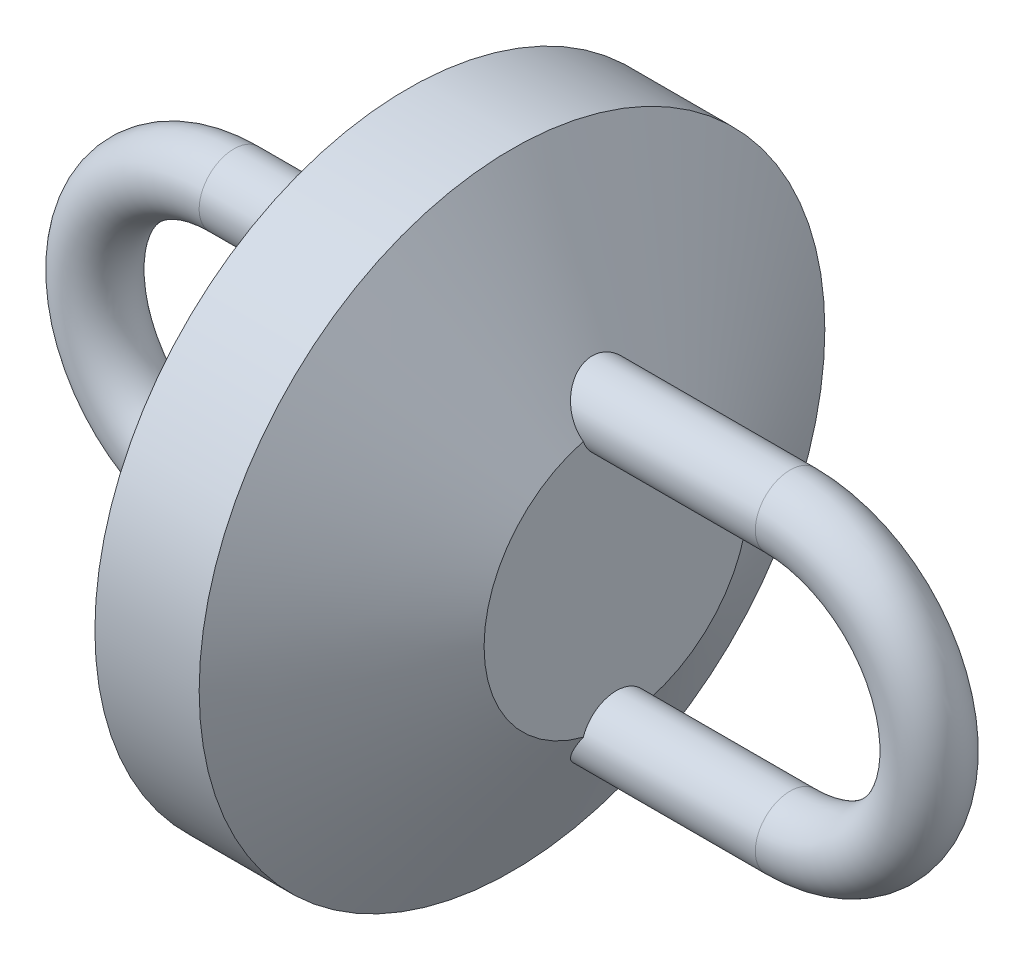
from build123d import *

# Parameters (mm, degrees)
SWEEP_1_PROFILE_R         = 1
SKETCH_9_R                = 9
EXTRUDE_1_DEPTH           = 3
EXTRUDE_1_TAPER           = 60
EXTRUDE_1_OTHER_WAY_DEPTH = 3


with BuildPart() as part:
    # 扫描1: sweep along a path in 草图1
    with BuildLine(Plane.XY) as sweep_1_path:
        Line((8, 4), (-8, 4))
        ThreePointArc((-8, 4), (-12, 0), (-8, -4))
        Line((-8, -4), (8, -4))
        ThreePointArc((8, -4), (12, 0), (8, 4))
    # 扫描1 profile (on start of the path) → 扫描1 (sweep)
    with BuildSketch(Plane(origin=(8, 4, 0), x_dir=(0, 0, -1), z_dir=(-1, 0, 0))):
        Circle(SWEEP_1_PROFILE_R)
    sweep(path=sweep_1_path.line)

    # 草图9 → 凸台-拉伸1 (add)
    with BuildSketch(Plane(origin=(0, 0, 0), x_dir=(0, 0, -1), z_dir=(1, 0, 0))):
        Circle(SKETCH_9_R)
    extrude(amount=EXTRUDE_1_DEPTH, taper=EXTRUDE_1_TAPER)

    # 草图9 → 凸台-拉伸1 other way (add)
    with BuildSketch(Plane(origin=(0, 0, 0), x_dir=(0, 0, -1), z_dir=(1, 0, 0))):
        Circle(SKETCH_9_R)
    extrude(amount=-EXTRUDE_1_OTHER_WAY_DEPTH)


solid = part.part
